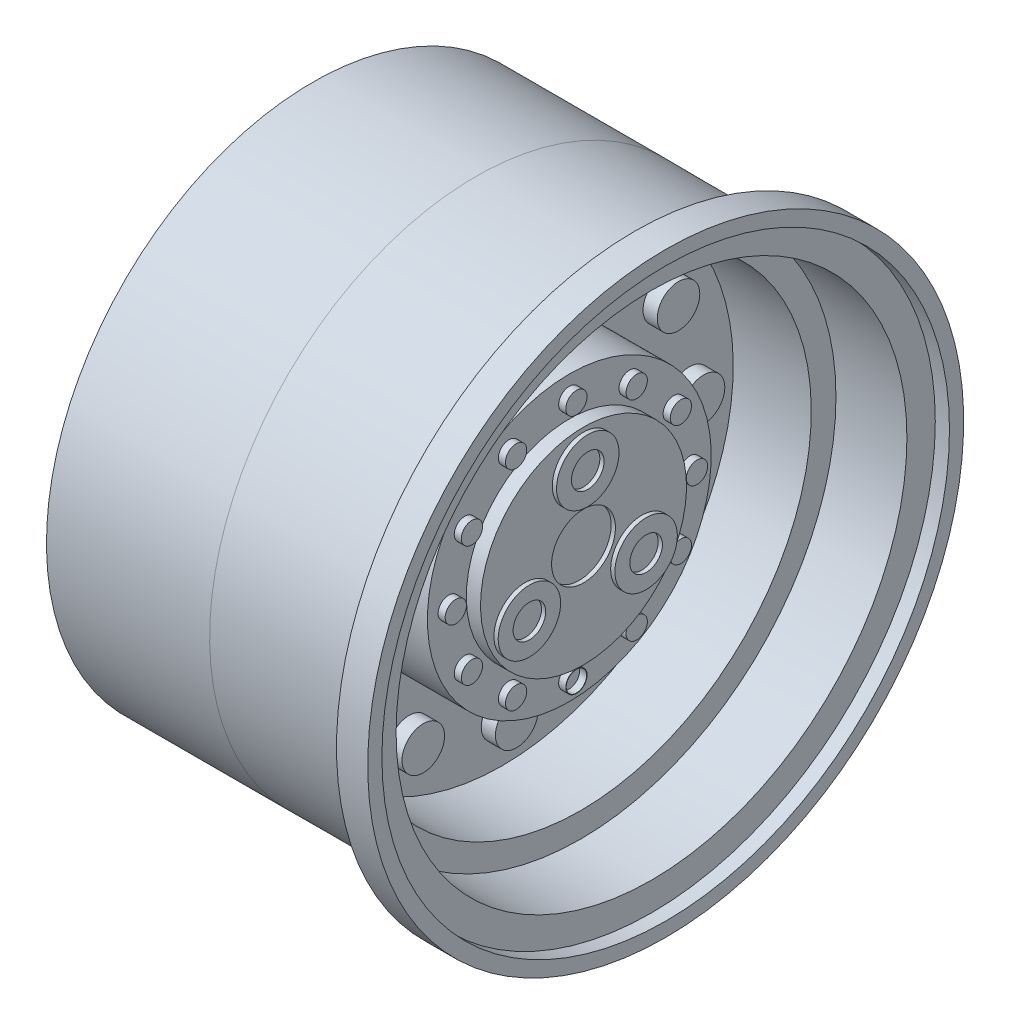
from build123d import *

# Parameters (mm, degrees)
SKETCH2_R              = 0.75
BOSS_EXTRUDE1_DEPTH    = 0.5
SKETCH3_R              = 0.375
SKETCH3_R_2            = 0.360290664
BOSS_EXTRUDE2_DEPTH    = 0.25
SKETCH4_R              = 1.125
CUT_EXTRUDE2_DEPTH     = 0.15
SKETCH5_R              = 1.1
SKETCH5_R_2            = 0.575
BOSS_EXTRUDE3_DEPTH    = 0.15
SKETCH6_R              = 0.375
BOSS_EXTRUDE4_DEPTH    = 0.25
BOSS_EXTRUDE4_2_DEPTH  = 0.25
BOSS_EXTRUDE4_3_DEPTH  = 0.25
BOSS_EXTRUDE4_4_DEPTH  = 0.25
BOSS_EXTRUDE4_5_DEPTH  = 0.25
BOSS_EXTRUDE4_6_DEPTH  = 0.25
BOSS_EXTRUDE4_7_DEPTH  = 0.25
BOSS_EXTRUDE4_8_DEPTH  = 0.25
BOSS_EXTRUDE4_9_DEPTH  = 0.25
BOSS_EXTRUDE4_10_DEPTH = 0.25
BOSS_EXTRUDE4_11_DEPTH = 0.25
BOSS_EXTRUDE4_12_DEPTH = 0.25
SKETCH7_R              = 1.25
CUT_EXTRUDE3_DEPTH     = 5


with BuildPart() as part:
    # Sketch1 → Revolve1 (revolve)
    with BuildSketch(Plane.XY, mode=Mode.PRIVATE) as revolve1_sk:
        Polygon((-3.5, 0), (3.794174888, 0), (3.794174888, 3.63), (3.294174888, 3.63), (3.294174888, 5), (0.94, 5), (0.94, 8.13), (3.69, 8.13), (3.69, 9), (6.19, 9), (6.19, 10), (6.69, 10), (6.69, 10.5), (5.59, 10.5), (5.59, 9.391227854), (0, 9.38), (-5.75, 9.38), (-5.75, 8.5), (-4.25, 8.5), (-4.25, 8.13), (-1.85, 8.13), (-1.85, 4.5), (-2.75, 4.5), (-2.75, 3.25), (-3.5, 3.25), align=None)
    revolve(revolve1_sk.sketch.rotate(Axis((-3.5, 0, 0), (1, 0, 0)), 180), axis=Axis((-3.5, 0, 0), (1, 0, 0)))

    # Sketch2 → Boss-Extrude1 (add)
    with BuildSketch(Plane(origin=(0.94, 0, 0), x_dir=(0, 0, -1), z_dir=(1, 0, 0))):
        with Locations(Location((-3.291833092, 5.701622165, 0), (0, 0, 270))):
            Circle(SKETCH2_R)
        with Locations(Location((0, 6.583666184, 0), (0, 0, 270))):
            Circle(SKETCH2_R)
        with Locations(Location((3.291833092, 5.701622165, 0), (0, 0, 270))):
            Circle(SKETCH2_R)
        with Locations(Location((5.701622165, 3.291833092, 0), (0, 0, 270))):
            Circle(SKETCH2_R)
        with Locations(Location((6.583666184, 0, 0), (0, 0, 270))):
            Circle(SKETCH2_R)
        with Locations(Location((-5.701622165, 3.291833092, 0), (0, 0, 270))):
            Circle(SKETCH2_R)
        with Locations(Location((-5.701622165, -3.291833092, 0), (0, 0, 270))):
            Circle(SKETCH2_R)
        with Locations(Location((-3.291833092, -5.701622165, 0), (0, 0, 270))):
            Circle(SKETCH2_R)
        with Locations(Location((0, -6.583666184, 0), (0, 0, 270))):
            Circle(SKETCH2_R)
        with Locations(Location((5.701622165, -3.291833092, 0), (0, 0, 270))):
            Circle(SKETCH2_R)
        with Locations(Location((-6.583666184, 0, 0), (0, 0, 270))):
            Circle(SKETCH2_R)
        with Locations(Location((3.291833092, -5.701622165, 0), (0, 0, 270))):
            Circle(SKETCH2_R)
    extrude(amount=BOSS_EXTRUDE1_DEPTH)

    # Sketch3 → Boss-Extrude2 (add)
    # profile 1 of 12: a face of its own
    with BuildSketch(Plane(origin=(3.294174888, 0, 0), x_dir=(0, 0, -1), z_dir=(1, 0, 0))):
        with Locations(Location((0, 4.25, 0), (0, 0, 270))):
            Circle(SKETCH3_R)
    # profile 2 of 12: a face of its own
    with BuildSketch(Plane(origin=(3.294174888, 0, 0), x_dir=(0, 0, -1), z_dir=(1, 0, 0))):
        with Locations(Location((2.125, 3.680607966, 0), (0, 0, 270))):
            Circle(SKETCH3_R)
    # profile 3 of 12: a face of its own
    with BuildSketch(Plane(origin=(3.294174888, 0, 0), x_dir=(0, 0, -1), z_dir=(1, 0, 0))):
        with Locations(Location((3.680607966, 2.125, 0), (0, 0, 270))):
            Circle(SKETCH3_R)
    # profile 4 of 12: a face of its own
    with BuildSketch(Plane(origin=(3.294174888, 0, 0), x_dir=(0, 0, -1), z_dir=(1, 0, 0))):
        with Locations(Location((4.25, 0, 0), (0, 0, 270))):
            Circle(SKETCH3_R)
    # profile 5 of 12: a face of its own
    with BuildSketch(Plane(origin=(3.294174888, 0, 0), x_dir=(0, 0, -1), z_dir=(1, 0, 0))):
        with Locations(Location((3.680607966, -2.125, 0), (0, 0, 270))):
            Circle(SKETCH3_R)
    # profile 6 of 12: a face of its own
    with BuildSketch(Plane(origin=(3.294174888, 0, 0), x_dir=(0, 0, -1), z_dir=(1, 0, 0))):
        with Locations(Location((2.125, -3.680607966, 0), (0, 0, 270))):
            Circle(SKETCH3_R)
    # profile 7 of 12: a face of its own
    with BuildSketch(Plane(origin=(3.294174888, 0, 0), x_dir=(0, 0, -1), z_dir=(1, 0, 0))):
        with Locations(Location((0, -4.25, 0), (0, 0, 270))):
            Circle(SKETCH3_R)
        with Locations(Location((0, -4.25, 0), (0, 0, 90))):
            Circle(SKETCH3_R_2, mode=Mode.SUBTRACT)
    # profile 8 of 12: a face of its own
    with BuildSketch(Plane(origin=(3.294174888, 0, 0), x_dir=(0, 0, -1), z_dir=(1, 0, 0))):
        with Locations(Location((-2.125, -3.680607966, 0), (0, 0, 270))):
            Circle(SKETCH3_R)
    # profile 9 of 12: a face of its own
    with BuildSketch(Plane(origin=(3.294174888, 0, 0), x_dir=(0, 0, -1), z_dir=(1, 0, 0))):
        with Locations(Location((-3.680607966, -2.125, 0), (0, 0, 270))):
            Circle(SKETCH3_R)
    # profile 10 of 12: a face of its own
    with BuildSketch(Plane(origin=(3.294174888, 0, 0), x_dir=(0, 0, -1), z_dir=(1, 0, 0))):
        with Locations(Location((-4.25, 0, 0), (0, 0, 270))):
            Circle(SKETCH3_R)
    # profile 11 of 12: a face of its own
    with BuildSketch(Plane(origin=(3.294174888, 0, 0), x_dir=(0, 0, -1), z_dir=(1, 0, 0))):
        with Locations(Location((-3.680607966, 2.125, 0), (0, 0, 270))):
            Circle(SKETCH3_R)
    # profile 12 of 12: a face of its own
    with BuildSketch(Plane(origin=(3.294174888, 0, 0), x_dir=(0, 0, -1), z_dir=(1, 0, 0))):
        with Locations(Location((-2.125, 3.680607966, 0), (0, 0, 270))):
            Circle(SKETCH3_R)
    extrude(amount=BOSS_EXTRUDE2_DEPTH)

    # Sketch4 → Cut-Extrude2 (cut)
    with BuildSketch(Plane(origin=(3.794174888, 0, 0), x_dir=(0, 0, -1), z_dir=(1, 0, 0))):
        with Locations(Location((0, 0, 0), (0, 0, 90))):
            Circle(SKETCH4_R)
    extrude(amount=-CUT_EXTRUDE2_DEPTH, mode=Mode.SUBTRACT)

    # Sketch5 → Boss-Extrude3 (add)
    # profile 1 of 3: a face of its own
    with BuildSketch(Plane(origin=(3.794174888, 0, 0), x_dir=(0, 0, -1), z_dir=(1, 0, 0))):
        with Locations(Location((0, 2.375, 0), (0, 0, 270))):
            Circle(SKETCH5_R)
        with Locations(Location((0, 2.375, 0), (0, 0, 90))):
            Circle(SKETCH5_R_2, mode=Mode.SUBTRACT)
    # profile 2 of 3: a face of its own
    with BuildSketch(Plane(origin=(3.794174888, 0, 0), x_dir=(0, 0, -1), z_dir=(1, 0, 0))):
        with Locations(Location((2.056810334, -1.1875, 0), (0, 0, 270))):
            Circle(SKETCH5_R)
        with Locations(Location((2.056810334, -1.1875, 0), (0, 0, 90))):
            Circle(SKETCH5_R_2, mode=Mode.SUBTRACT)
    # profile 3 of 3: a face of its own
    with BuildSketch(Plane(origin=(3.794174888, 0, 0), x_dir=(0, 0, -1), z_dir=(1, 0, 0))):
        with Locations(Location((-2.056810334, -1.1875, 0), (0, 0, 270))):
            Circle(SKETCH5_R)
        with Locations(Location((-2.056810334, -1.1875, 0), (0, 0, 90))):
            Circle(SKETCH5_R_2, mode=Mode.SUBTRACT)
    extrude(amount=BOSS_EXTRUDE3_DEPTH)

    # Sketch7 → Cut-Extrude3 (cut)
    with BuildSketch(Plane.ZY.offset(3.5)):
        with Locations(Location((0, 0, 0), (0, 0, 270))):
            Circle(SKETCH7_R)
    extrude(amount=-CUT_EXTRUDE3_DEPTH, mode=Mode.SUBTRACT)


with BuildPart() as body_2:
    # Sketch6 → Boss-Extrude4 (new body)
    with BuildSketch(Plane.ZY.offset(3.5)):
        with Locations(Location((0, 3.81, 0), (0, 0, 270))):
            Circle(SKETCH6_R)
    extrude(amount=BOSS_EXTRUDE4_DEPTH)


with BuildPart() as body_3:
    # Sketch6 → Boss-Extrude4 2 (new body)
    with BuildSketch(Plane.ZY.offset(3.5)):
        with Locations(Location((1.905, 3.299556788, 0), (0, 0, 270))):
            Circle(SKETCH6_R)
    extrude(amount=BOSS_EXTRUDE4_2_DEPTH)


with BuildPart() as body_4:
    # Sketch6 → Boss-Extrude4 3 (new body)
    with BuildSketch(Plane.ZY.offset(3.5)):
        with Locations(Location((3.299556788, 1.905, 0), (0, 0, 270))):
            Circle(SKETCH6_R)
    extrude(amount=BOSS_EXTRUDE4_3_DEPTH)


with BuildPart() as body_5:
    # Sketch6 → Boss-Extrude4 4 (new body)
    with BuildSketch(Plane.ZY.offset(3.5)):
        with Locations(Location((3.81, 0, 0), (0, 0, 270))):
            Circle(SKETCH6_R)
    extrude(amount=BOSS_EXTRUDE4_4_DEPTH)


with BuildPart() as body_6:
    # Sketch6 → Boss-Extrude4 5 (new body)
    with BuildSketch(Plane.ZY.offset(3.5)):
        with Locations(Location((3.299556788, -1.905, 0), (0, 0, 270))):
            Circle(SKETCH6_R)
    extrude(amount=BOSS_EXTRUDE4_5_DEPTH)


with BuildPart() as body_7:
    # Sketch6 → Boss-Extrude4 6 (new body)
    with BuildSketch(Plane.ZY.offset(3.5)):
        with Locations(Location((1.905, -3.299556788, 0), (0, 0, 270))):
            Circle(SKETCH6_R)
    extrude(amount=BOSS_EXTRUDE4_6_DEPTH)


with BuildPart() as body_8:
    # Sketch6 → Boss-Extrude4 7 (new body)
    with BuildSketch(Plane.ZY.offset(3.5)):
        with Locations(Location((0, -3.81, 0), (0, 0, 270))):
            Circle(SKETCH6_R)
    extrude(amount=BOSS_EXTRUDE4_7_DEPTH)


with BuildPart() as body_9:
    # Sketch6 → Boss-Extrude4 8 (new body)
    with BuildSketch(Plane.ZY.offset(3.5)):
        with Locations(Location((-1.905, -3.299556788, 0), (0, 0, 270))):
            Circle(SKETCH6_R)
    extrude(amount=BOSS_EXTRUDE4_8_DEPTH)


with BuildPart() as body_10:
    # Sketch6 → Boss-Extrude4 9 (new body)
    with BuildSketch(Plane.ZY.offset(3.5)):
        with Locations(Location((-3.299556788, -1.905, 0), (0, 0, 270))):
            Circle(SKETCH6_R)
    extrude(amount=BOSS_EXTRUDE4_9_DEPTH)


with BuildPart() as body_11:
    # Sketch6 → Boss-Extrude4 10 (new body)
    with BuildSketch(Plane.ZY.offset(3.5)):
        with Locations(Location((-3.81, 0, 0), (0, 0, 270))):
            Circle(SKETCH6_R)
    extrude(amount=BOSS_EXTRUDE4_10_DEPTH)


with BuildPart() as body_12:
    # Sketch6 → Boss-Extrude4 11 (new body)
    with BuildSketch(Plane.ZY.offset(3.5)):
        with Locations(Location((-3.299556788, 1.905, 0), (0, 0, 270))):
            Circle(SKETCH6_R)
    extrude(amount=BOSS_EXTRUDE4_11_DEPTH)


with BuildPart() as body_13:
    # Sketch6 → Boss-Extrude4 12 (new body)
    with BuildSketch(Plane.ZY.offset(3.5)):
        with Locations(Location((-1.905, 3.299556788, 0), (0, 0, 270))):
            Circle(SKETCH6_R)
    extrude(amount=BOSS_EXTRUDE4_12_DEPTH)


solid = Compound([part.part, body_2.part, body_3.part, body_4.part, body_5.part, body_6.part, body_7.part, body_8.part, body_9.part, body_10.part, body_11.part, body_12.part, body_13.part])
